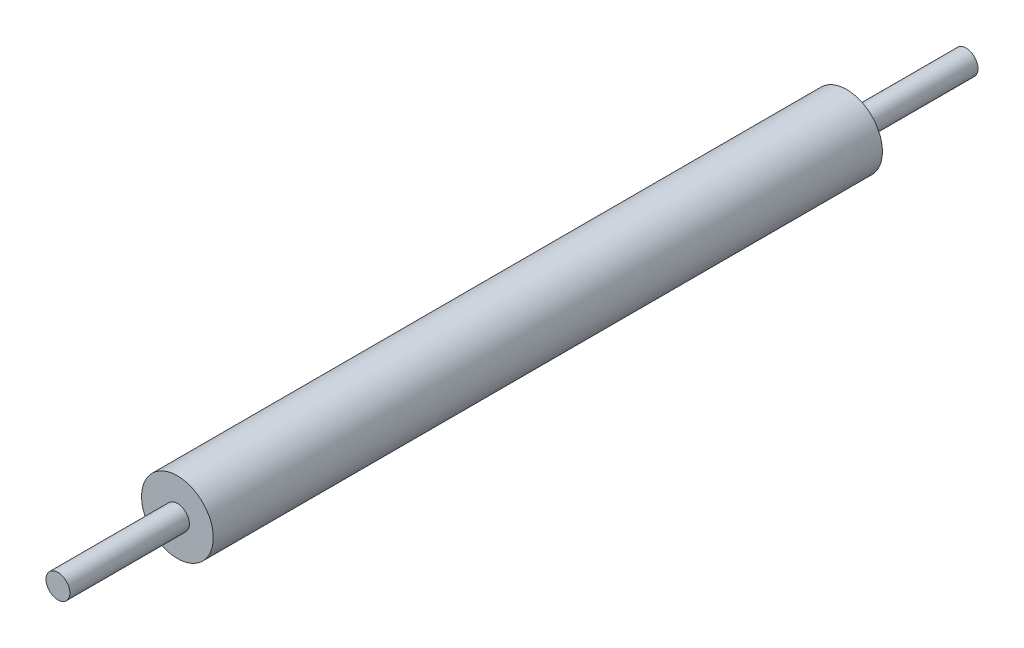
from build123d import *

# Parameters (mm, degrees)
SKETCH1_R           = 38.1
BOSS_EXTRUDE5_DEPTH = 711.2
SKETCH3_R           = 12.7
BOSS_EXTRUDE8_DEPTH = 127
BOSS_EXTRUDE9_START = 127
SKETCH4_R           = 12.7
BOSS_EXTRUDE9_DEPTH = 127


with BuildPart() as part:
    # Sketch1 → Boss-Extrude5 (new body)
    with BuildSketch(Plane.XY):
        Circle(SKETCH1_R)
    extrude(amount=BOSS_EXTRUDE5_DEPTH)

    # Sketch3 → Boss-Extrude8 (add)
    with BuildSketch(Plane.XY.offset(711.2)):
        Circle(SKETCH3_R)
    extrude(amount=BOSS_EXTRUDE8_DEPTH)

    # Sketch4 → Boss-Extrude9 (add)
    with BuildSketch(Plane(origin=(0, 0, 0), x_dir=(-1, 0, 0), z_dir=(0, 0, -1)).offset(BOSS_EXTRUDE9_START)):
        with Locations(Location((0, 0, 0), (0, 0, 180))):
            Circle(SKETCH4_R)
    extrude(amount=-BOSS_EXTRUDE9_DEPTH)


solid = part.part
